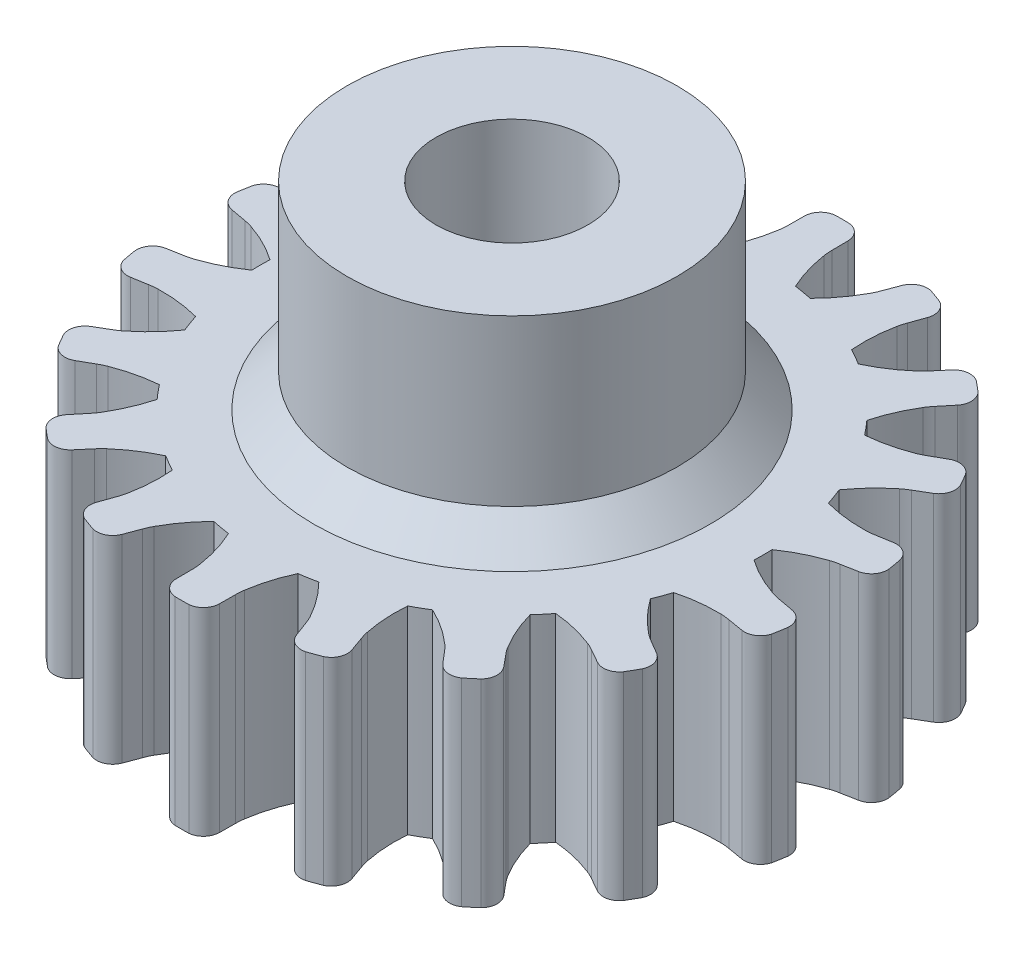
from build123d import *

# Parameters (mm, degrees)
BOSS_EXTRUDE1_DEPTH = 6
SKETCH2_R           = 5
BOSS_EXTRUDE2_DEPTH = 6
CHAMFER1_SIZE       = 1
SKETCH3_R           = 2.3
CUT_EXTRUDE1_DEPTH  = 4


with BuildPart() as part:
    # Sketch1 → Boss-Extrude1 (new body)
    with BuildSketch(Plane(origin=(0, 0, 0), x_dir=(1, 0, 0), z_dir=(0, 1, 0))):
        with BuildLine():
            ThreePointArc((-1.05, 0), (-0.819092284, -0.606591022), (-0.677444455, -1.24))
            ThreePointArc((-0.677444455, -1.24), (-0.66323771, -1.369319538), (-0.659080432, -1.499350656))
            Line((-0.659080432, -1.499350656), (-0.654982139, -1.97933316))
            ThreePointArc((-0.654982139, -1.97933316), (-0.526255599, -2.306199924), (-0.21184217, -2.462905379))
            ThreePointArc((-0.21184217, -2.462905379), (0, -2.465149486), (0.21184217, -2.462905379))
            ThreePointArc((0.21184217, -2.462905379), (0.526255599, -2.306199924), (0.654982139, -1.97933316))
            Line((0.654982139, -1.97933316), (0.659080432, -1.499350656))
            ThreePointArc((0.659080432, -1.499350656), (0.66323771, -1.369319538), (0.677444455, -1.24))
            ThreePointArc((0.677444455, -1.24), (0.819092284, -0.606591022), (1.05, 0))
            ThreePointArc((1.05, 0), (1.321056085, 0.042769155), (1.590393401, 0.095285937))
            ThreePointArc((1.590393401, 0.095285937), (2.014842026, -0.39574808), (2.364586075, -0.942511412))
            ThreePointArc((2.364586075, -0.942511412), (2.422165935, -1.059173035), (2.470545761, -1.179940444))
            Line((2.470545761, -1.179940444), (2.638560581, -1.629574762))
            ThreePointArc((2.638560581, -1.629574762), (2.871318978, -1.892701979), (3.220367379, -1.932421213))
            ThreePointArc((3.220367379, -1.932421213), (3.420201433, -1.862075694), (3.618500427, -1.787512634))
            ThreePointArc((3.618500427, -1.787512634), (3.860355984, -1.532721948), (3.869524347, -1.181540592))
            Line((3.869524347, -1.181540592), (3.709211797, -0.729102876))
            ThreePointArc((3.709211797, -0.729102876), (3.6686451, -0.605491721), (3.637765186, -0.479112113))
            ThreePointArc((3.637765186, -0.479112113), (3.554231976, 0.164544041), (3.563747905, 0.813528238))
            ThreePointArc((3.563747905, 0.813528238), (3.803829395, 0.946424738), (4.038961886, 1.087893158))
            ThreePointArc((4.038961886, 1.087893158), (4.605756652, 0.771642095), (5.121412627, 0.377472136))
            ThreePointArc((5.121412627, 0.377472136), (5.215420621, 0.287539543), (5.302187673, 0.190602175))
            Line((5.302187673, 0.190602175), (5.613853953, -0.174451424))
            ThreePointArc((5.613853953, -0.174451424), (5.922570111, -0.342102067), (6.264153095, -0.260044354))
            ThreePointArc((6.264153095, -0.260044354), (6.427876097, -0.125593917), (6.58871413, 0.012294691))
            ThreePointArc((6.58871413, 0.012294691), (6.728840465, 0.33443909), (6.61734481, 0.667577384))
            Line((6.61734481, 0.667577384), (6.311957478, 1.037899645))
            ThreePointArc((6.311957478, 1.037899645), (6.231559746, 1.140181507), (6.159317748, 1.248377941))
            ThreePointArc((6.159317748, 1.248377941), (5.860678836, 1.824646838), (5.647655216, 2.437747138))
            ThreePointArc((5.647655216, 2.437747138), (5.827804741, 2.644741705), (6.000371959, 2.858098583))
            ThreePointArc((6.000371959, 2.858098583), (6.641149051, 2.75477502), (7.260521232, 2.560741149))
            ThreePointArc((7.260521232, 2.560741149), (7.379618609, 2.508384782), (7.4943075, 2.446969532))
            Line((7.4943075, 2.446969532), (7.912033688, 2.210527505))
            ThreePointArc((7.912033688, 2.210527505), (8.25947188, 2.158574578), (8.552389499, 2.352511867))
            ThreePointArc((8.552389499, 2.352511867), (8.660254038, 2.534850514), (8.764231669, 2.719433268))
            ThreePointArc((8.764231669, 2.719433268), (8.785727478, 3.070076012), (8.567015827, 3.344989849))
            Line((8.567015827, 3.344989849), (8.153387932, 3.588530326))
            ThreePointArc((8.153387932, 3.588530326), (8.04285632, 3.657146194), (7.937965687, 3.734109365))
            ThreePointArc((7.937965687, 3.734109365), (7.460241335, 4.173484472), (7.050371959, 4.676751931))
            ThreePointArc((7.050371959, 4.676751931), (7.148860827, 4.932877964), (7.238048617, 5.192389312))
            ThreePointArc((7.238048617, 5.192389312), (7.875520863, 5.314455596), (8.523903822, 5.343961161))
            ThreePointArc((8.523903822, 5.343961161), (8.653725682, 5.335495972), (8.782503238, 5.317010425))
            Line((8.782503238, 5.317010425), (9.25590539, 5.237698368))
            ThreePointArc((9.25590539, 5.237698368), (9.600159443, 5.307709445), (9.809081509, 5.590134611))
            ThreePointArc((9.809081509, 5.590134611), (9.84807753, 5.798368737), (9.882653523, 6.007382234))
            ThreePointArc((9.882653523, 6.007382234), (9.782926095, 6.344230633), (9.4833783, 6.527761346))
            Line((9.4833783, 6.527761346), (9.01139947, 6.615145463))
            ThreePointArc((9.01139947, 6.615145463), (8.884065721, 6.64181925), (8.759177813, 6.678266265))
            ThreePointArc((8.759177813, 6.678266265), (8.159988627, 6.927752459), (7.60270979, 7.260485594))
            ThreePointArc((7.60270979, 7.260485594), (7.60765879, 7.534850514), (7.60270979, 7.809215434))
            ThreePointArc((7.60270979, 7.809215434), (8.159988627, 8.141948569), (8.759177813, 8.391434763))
            ThreePointArc((8.759177813, 8.391434763), (8.884065721, 8.427881778), (9.01139947, 8.454555565))
            Line((9.01139947, 8.454555565), (9.4833783, 8.541939682))
            ThreePointArc((9.4833783, 8.541939682), (9.782926095, 8.725470395), (9.882653523, 9.062318794))
            ThreePointArc((9.882653523, 9.062318794), (9.84807753, 9.271332291), (9.809081509, 9.479566417))
            ThreePointArc((9.809081509, 9.479566417), (9.600159443, 9.761991582), (9.25590539, 9.83200266))
            Line((9.25590539, 9.83200266), (8.782503238, 9.752690603))
            ThreePointArc((8.782503238, 9.752690603), (8.653725682, 9.734205056), (8.523903822, 9.725739867))
            ThreePointArc((8.523903822, 9.725739867), (7.875520863, 9.755245432), (7.238048617, 9.877311715))
            ThreePointArc((7.238048617, 9.877311715), (7.148860827, 10.136823064), (7.050371959, 10.392949097))
            ThreePointArc((7.050371959, 10.392949097), (7.460241335, 10.896216556), (7.937965687, 11.335591663))
            ThreePointArc((7.937965687, 11.335591663), (8.04285632, 11.412554834), (8.153387932, 11.481170702))
            Line((8.153387932, 11.481170702), (8.567015827, 11.724711179))
            ThreePointArc((8.567015827, 11.724711179), (8.785727478, 11.999625015), (8.764231669, 12.35026776))
            ThreePointArc((8.764231669, 12.35026776), (8.660254038, 12.534850514), (8.552389499, 12.717189161))
            ThreePointArc((8.552389499, 12.717189161), (8.25947188, 12.91112645), (7.912033688, 12.859173522))
            Line((7.912033688, 12.859173522), (7.4943075, 12.622731496))
            ThreePointArc((7.4943075, 12.622731496), (7.379618609, 12.561316246), (7.260521232, 12.508959879))
            ThreePointArc((7.260521232, 12.508959879), (6.641149051, 12.314926007), (6.000371959, 12.211602445))
            ThreePointArc((6.000371959, 12.211602445), (5.827804741, 12.424959323), (5.647655216, 12.63195389))
            ThreePointArc((5.647655216, 12.63195389), (5.860678836, 13.24505419), (6.159317748, 13.821323087))
            ThreePointArc((6.159317748, 13.821323087), (6.231559746, 13.92951952), (6.311957478, 14.031801383))
            Line((6.311957478, 14.031801383), (6.61734481, 14.402123644))
            ThreePointArc((6.61734481, 14.402123644), (6.728840465, 14.735261938), (6.58871413, 15.057406337))
            ThreePointArc((6.58871413, 15.057406337), (6.427876097, 15.195294945), (6.264153095, 15.329745381))
            ThreePointArc((6.264153095, 15.329745381), (5.922570111, 15.411803095), (5.613853953, 15.244152451))
            Line((5.613853953, 15.244152451), (5.302187673, 14.879098853))
            ThreePointArc((5.302187673, 14.879098853), (5.215420621, 14.782161485), (5.121412627, 14.692228891))
            ThreePointArc((5.121412627, 14.692228891), (4.605756652, 14.298058932), (4.038961886, 13.98180787))
            ThreePointArc((4.038961886, 13.98180787), (3.803829395, 14.123276289), (3.563747905, 14.25617279))
            ThreePointArc((3.563747905, 14.25617279), (3.554231976, 14.905156987), (3.637765186, 15.548813141))
            ThreePointArc((3.637765186, 15.548813141), (3.6686451, 15.675192749), (3.709211797, 15.798803904))
            Line((3.709211797, 15.798803904), (3.869524347, 16.251241619))
            ThreePointArc((3.869524347, 16.251241619), (3.860355984, 16.602422976), (3.618500427, 16.857213662))
            ThreePointArc((3.618500427, 16.857213662), (3.420201433, 16.931776722), (3.220367379, 17.00212224))
            ThreePointArc((3.220367379, 17.00212224), (2.871318978, 16.962403006), (2.638560581, 16.69927579))
            Line((2.638560581, 16.69927579), (2.470545761, 16.249641471))
            ThreePointArc((2.470545761, 16.249641471), (2.422165935, 16.128874063), (2.364586075, 16.01221244))
            ThreePointArc((2.364586075, 16.01221244), (2.014842026, 15.465449108), (1.590393401, 14.974415091))
            ThreePointArc((1.590393401, 14.974415091), (1.321056085, 15.026931873), (1.05, 15.069701028))
            ThreePointArc((1.05, 15.069701028), (0.819092284, 15.676292049), (0.677444455, 16.309701028))
            ThreePointArc((0.677444455, 16.309701028), (0.66323771, 16.439020566), (0.659080432, 16.569051684))
            Line((0.659080432, 16.569051684), (0.654982139, 17.049034187))
            ThreePointArc((0.654982139, 17.049034187), (0.526255599, 17.375900952), (0.21184217, 17.532606407))
            ThreePointArc((0.21184217, 17.532606407), (0, 17.534850514), (-0.21184217, 17.532606407))
            ThreePointArc((-0.21184217, 17.532606407), (-0.526255599, 17.375900952), (-0.654982139, 17.049034187))
            Line((-0.654982139, 17.049034187), (-0.659080432, 16.569051684))
            ThreePointArc((-0.659080432, 16.569051684), (-0.66323771, 16.439020566), (-0.677444455, 16.309701028))
            ThreePointArc((-0.677444455, 16.309701028), (-0.819092284, 15.676292049), (-1.05, 15.069701028))
            ThreePointArc((-1.05, 15.069701028), (-1.321056085, 15.026931873), (-1.590393401, 14.974415091))
            ThreePointArc((-1.590393401, 14.974415091), (-2.014842026, 15.465449108), (-2.364586075, 16.01221244))
            ThreePointArc((-2.364586075, 16.01221244), (-2.422165935, 16.128874063), (-2.470545761, 16.249641471))
            Line((-2.470545761, 16.249641471), (-2.638560581, 16.69927579))
            ThreePointArc((-2.638560581, 16.69927579), (-2.871318978, 16.962403006), (-3.220367379, 17.00212224))
            ThreePointArc((-3.220367379, 17.00212224), (-3.420201433, 16.931776722), (-3.618500427, 16.857213662))
            ThreePointArc((-3.618500427, 16.857213662), (-3.860355984, 16.602422976), (-3.869524347, 16.251241619))
            Line((-3.869524347, 16.251241619), (-3.709211797, 15.798803904))
            ThreePointArc((-3.709211797, 15.798803904), (-3.6686451, 15.675192749), (-3.637765186, 15.548813141))
            ThreePointArc((-3.637765186, 15.548813141), (-3.554231976, 14.905156987), (-3.563747905, 14.25617279))
            ThreePointArc((-3.563747905, 14.25617279), (-3.803829395, 14.123276289), (-4.038961886, 13.98180787))
            ThreePointArc((-4.038961886, 13.98180787), (-4.605756652, 14.298058932), (-5.121412627, 14.692228891))
            ThreePointArc((-5.121412627, 14.692228891), (-5.215420621, 14.782161485), (-5.302187673, 14.879098853))
            Line((-5.302187673, 14.879098853), (-5.613853953, 15.244152451))
            ThreePointArc((-5.613853953, 15.244152451), (-5.922570111, 15.411803095), (-6.264153095, 15.329745381))
            ThreePointArc((-6.264153095, 15.329745381), (-6.427876097, 15.195294945), (-6.58871413, 15.057406337))
            ThreePointArc((-6.58871413, 15.057406337), (-6.728840465, 14.735261938), (-6.61734481, 14.402123644))
            Line((-6.61734481, 14.402123644), (-6.311957478, 14.031801383))
            ThreePointArc((-6.311957478, 14.031801383), (-6.231559746, 13.92951952), (-6.159317748, 13.821323087))
            ThreePointArc((-6.159317748, 13.821323087), (-5.860678836, 13.24505419), (-5.647655216, 12.63195389))
            ThreePointArc((-5.647655216, 12.63195389), (-5.827804741, 12.424959323), (-6.000371959, 12.211602445))
            ThreePointArc((-6.000371959, 12.211602445), (-6.641149051, 12.314926007), (-7.260521232, 12.508959879))
            ThreePointArc((-7.260521232, 12.508959879), (-7.379618609, 12.561316246), (-7.4943075, 12.622731496))
            Line((-7.4943075, 12.622731496), (-7.912033688, 12.859173522))
            ThreePointArc((-7.912033688, 12.859173522), (-8.25947188, 12.91112645), (-8.552389499, 12.717189161))
            ThreePointArc((-8.552389499, 12.717189161), (-8.660254038, 12.534850514), (-8.764231669, 12.35026776))
            ThreePointArc((-8.764231669, 12.35026776), (-8.785727478, 11.999625015), (-8.567015827, 11.724711179))
            Line((-8.567015827, 11.724711179), (-8.153387932, 11.481170702))
            ThreePointArc((-8.153387932, 11.481170702), (-8.04285632, 11.412554834), (-7.937965687, 11.335591663))
            ThreePointArc((-7.937965687, 11.335591663), (-7.460241335, 10.896216556), (-7.050371959, 10.392949097))
            ThreePointArc((-7.050371959, 10.392949097), (-7.148860827, 10.136823064), (-7.238048617, 9.877311715))
            ThreePointArc((-7.238048617, 9.877311715), (-7.875520863, 9.755245432), (-8.523903822, 9.725739867))
            ThreePointArc((-8.523903822, 9.725739867), (-8.653725682, 9.734205056), (-8.782503238, 9.752690603))
            Line((-8.782503238, 9.752690603), (-9.25590539, 9.83200266))
            ThreePointArc((-9.25590539, 9.83200266), (-9.600159443, 9.761991582), (-9.809081509, 9.479566417))
            ThreePointArc((-9.809081509, 9.479566417), (-9.84807753, 9.271332291), (-9.882653523, 9.062318794))
            ThreePointArc((-9.882653523, 9.062318794), (-9.782926095, 8.725470395), (-9.4833783, 8.541939682))
            Line((-9.4833783, 8.541939682), (-9.01139947, 8.454555565))
            ThreePointArc((-9.01139947, 8.454555565), (-8.884065721, 8.427881778), (-8.759177813, 8.391434763))
            ThreePointArc((-8.759177813, 8.391434763), (-8.159988627, 8.141948569), (-7.60270979, 7.809215434))
            ThreePointArc((-7.60270979, 7.809215434), (-7.60765879, 7.534850514), (-7.60270979, 7.260485594))
            ThreePointArc((-7.60270979, 7.260485594), (-8.159988627, 6.927752459), (-8.759177813, 6.678266265))
            ThreePointArc((-8.759177813, 6.678266265), (-8.884065721, 6.64181925), (-9.01139947, 6.615145463))
            Line((-9.01139947, 6.615145463), (-9.4833783, 6.527761346))
            ThreePointArc((-9.4833783, 6.527761346), (-9.782926095, 6.344230633), (-9.882653523, 6.007382234))
            ThreePointArc((-9.882653523, 6.007382234), (-9.84807753, 5.798368737), (-9.809081509, 5.590134611))
            ThreePointArc((-9.809081509, 5.590134611), (-9.600159443, 5.307709445), (-9.25590539, 5.237698368))
            Line((-9.25590539, 5.237698368), (-8.782503238, 5.317010425))
            ThreePointArc((-8.782503238, 5.317010425), (-8.653725682, 5.335495972), (-8.523903822, 5.343961161))
            ThreePointArc((-8.523903822, 5.343961161), (-7.875520863, 5.314455596), (-7.238048617, 5.192389312))
            ThreePointArc((-7.238048617, 5.192389312), (-7.148860827, 4.932877964), (-7.050371959, 4.676751931))
            ThreePointArc((-7.050371959, 4.676751931), (-7.460241335, 4.173484472), (-7.937965687, 3.734109365))
            ThreePointArc((-7.937965687, 3.734109365), (-8.04285632, 3.657146194), (-8.153387932, 3.588530326))
            Line((-8.153387932, 3.588530326), (-8.567015827, 3.344989849))
            ThreePointArc((-8.567015827, 3.344989849), (-8.785727478, 3.070076012), (-8.764231669, 2.719433268))
            ThreePointArc((-8.764231669, 2.719433268), (-8.660254038, 2.534850514), (-8.552389499, 2.352511867))
            ThreePointArc((-8.552389499, 2.352511867), (-8.25947188, 2.158574578), (-7.912033688, 2.210527505))
            Line((-7.912033688, 2.210527505), (-7.4943075, 2.446969532))
            ThreePointArc((-7.4943075, 2.446969532), (-7.379618609, 2.508384782), (-7.260521232, 2.560741149))
            ThreePointArc((-7.260521232, 2.560741149), (-6.641149051, 2.75477502), (-6.000371959, 2.858098583))
            ThreePointArc((-6.000371959, 2.858098583), (-5.827804741, 2.644741705), (-5.647655216, 2.437747138))
            ThreePointArc((-5.647655216, 2.437747138), (-5.860678836, 1.824646838), (-6.159317748, 1.248377941))
            ThreePointArc((-6.159317748, 1.248377941), (-6.231559746, 1.140181507), (-6.311957478, 1.037899645))
            Line((-6.311957478, 1.037899645), (-6.61734481, 0.667577384))
            ThreePointArc((-6.61734481, 0.667577384), (-6.728840465, 0.33443909), (-6.58871413, 0.012294691))
            ThreePointArc((-6.58871413, 0.012294691), (-6.427876097, -0.125593917), (-6.264153095, -0.260044354))
            ThreePointArc((-6.264153095, -0.260044354), (-5.922570111, -0.342102067), (-5.613853953, -0.174451424))
            Line((-5.613853953, -0.174451424), (-5.302187673, 0.190602175))
            ThreePointArc((-5.302187673, 0.190602175), (-5.215420621, 0.287539543), (-5.121412627, 0.377472136))
            ThreePointArc((-5.121412627, 0.377472136), (-4.605756652, 0.771642095), (-4.038961886, 1.087893158))
            ThreePointArc((-4.038961886, 1.087893158), (-3.803829395, 0.946424738), (-3.563747905, 0.813528238))
            ThreePointArc((-3.563747905, 0.813528238), (-3.554231976, 0.164544041), (-3.637765186, -0.479112113))
            ThreePointArc((-3.637765186, -0.479112113), (-3.6686451, -0.605491721), (-3.709211797, -0.729102876))
            Line((-3.709211797, -0.729102876), (-3.869524347, -1.181540592))
            ThreePointArc((-3.869524347, -1.181540592), (-3.860355984, -1.532721948), (-3.618500427, -1.787512634))
            ThreePointArc((-3.618500427, -1.787512634), (-3.420201433, -1.862075694), (-3.220367379, -1.932421213))
            ThreePointArc((-3.220367379, -1.932421213), (-2.871318978, -1.892701979), (-2.638560581, -1.629574762))
            Line((-2.638560581, -1.629574762), (-2.470545761, -1.179940444))
            ThreePointArc((-2.470545761, -1.179940444), (-2.422165935, -1.059173035), (-2.364586075, -0.942511412))
            ThreePointArc((-2.364586075, -0.942511412), (-2.014842026, -0.39574808), (-1.590393401, 0.095285937))
            ThreePointArc((-1.590393401, 0.095285937), (-1.321056085, 0.042769155), (-1.05, 0))
        make_face()
    extrude(amount=BOSS_EXTRUDE1_DEPTH)

    # Sketch2 → Boss-Extrude2 (add)
    with BuildSketch(Plane(origin=(0, 6, 0), x_dir=(1, 0, 0), z_dir=(0, 1, 0))):
        with Locations(Location((0, 7.534850514, 0), (0, 0, 270))):
            Circle(SKETCH2_R)
    extrude(amount=BOSS_EXTRUDE2_DEPTH)

    # Chamfer1
    chamfer1_edges = [part.edges().sort_by_distance(p)[0] for p in [
        (0, 6, -12.534850514),
    ]]
    chamfer(chamfer1_edges, length=CHAMFER1_SIZE)

    # Sketch3 → Cut-Extrude1 (cut)
    with BuildSketch(Plane(origin=(0, 12, 0), x_dir=(1, 0, 0), z_dir=(0, 1, 0))):
        with Locations(Location((0, 7.534850514, 0), (0, 0, 270))):
            Circle(SKETCH3_R)
    extrude(amount=-CUT_EXTRUDE1_DEPTH, mode=Mode.SUBTRACT)


solid = part.part
